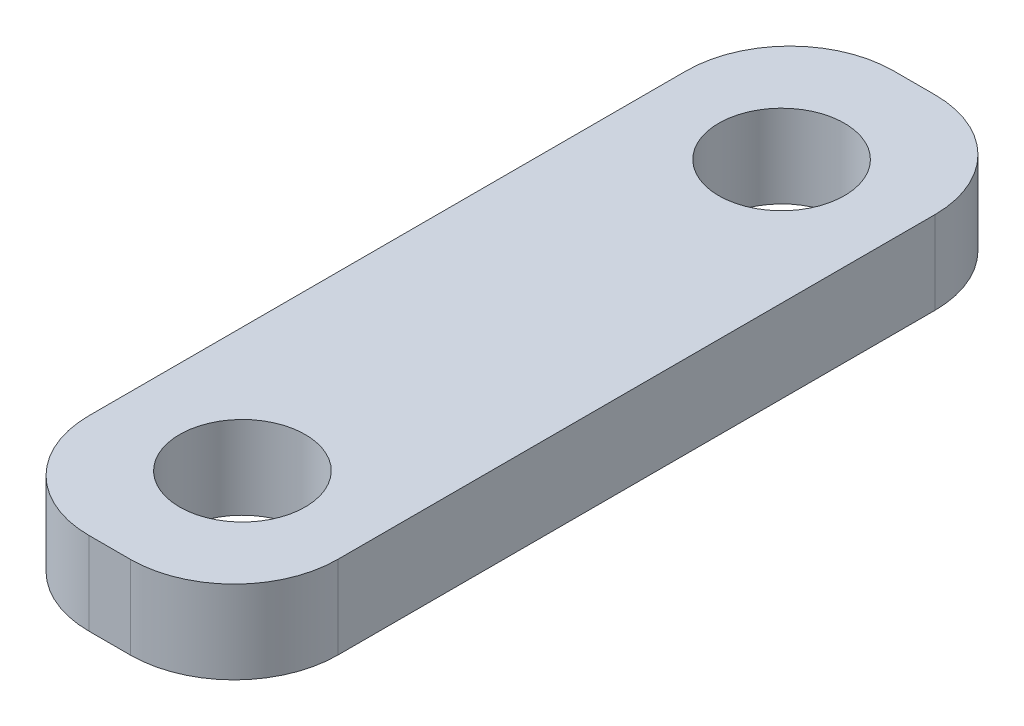
from build123d import *

# Parameters (mm, degrees)
SKETCH_1_W      = 6
SKETCH_1_H      = 19.4
SKETCH_1_R      = 1.515
EXTRUDE_1_DEPTH = 2
FILLET_1_R      = 2.5


with BuildPart() as part:
    # 草图1 → 凸台-拉伸1 (new body)
    with BuildSketch(Plane(origin=(0, 0, 0), x_dir=(1, 0, 0), z_dir=(0, 1, 0))):
        with Locations((3, 9.7)):
            Rectangle(SKETCH_1_W, SKETCH_1_H)
        with Locations(Location((3, 16.2, 0), (0, 0, 270))):
            Circle(SKETCH_1_R, mode=Mode.SUBTRACT)
        with Locations(Location((3, 3.2, 0), (0, 0, 270))):
            Circle(SKETCH_1_R, mode=Mode.SUBTRACT)
    extrude(amount=EXTRUDE_1_DEPTH)

    # 圆角1
    fillet_1_edges = [part.edges().sort_by_distance(p)[0] for p in [
        (0, 1, -19.4),
        (6, 1, -19.4),
        (6, 1, 0),
        (0, 1, 0),
    ]]
    fillet(fillet_1_edges, radius=FILLET_1_R)


solid = part.part
